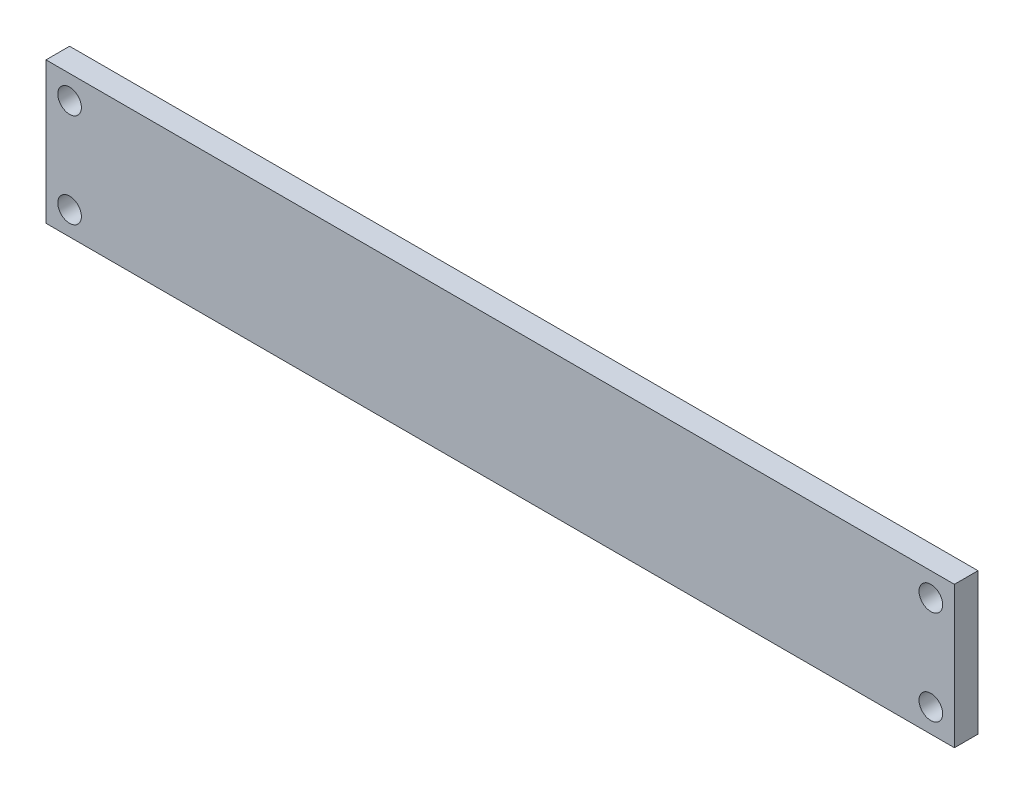
from build123d import *

# Parameters (mm, degrees)
SZKIC1_W                    = 385
SZKIC1_H                    = 60
SZKIC1_R                    = 5
DODANIE_WYCI_GNI_CIE1_DEPTH = 10


with BuildPart() as part:
    # Szkic1 → Dodanie-wyciągnięcie1 (new body)
    with BuildSketch(Plane.XY):
        Rectangle(SZKIC1_W, SZKIC1_H)
        with Locations((-182.5, 20)):
            Circle(SZKIC1_R, mode=Mode.SUBTRACT)
        with Locations((182.5, 20)):
            Circle(SZKIC1_R, mode=Mode.SUBTRACT)
        with Locations((182.5, -20)):
            Circle(SZKIC1_R, mode=Mode.SUBTRACT)
        with Locations((-182.5, -20)):
            Circle(SZKIC1_R, mode=Mode.SUBTRACT)
    extrude(amount=DODANIE_WYCI_GNI_CIE1_DEPTH)


solid = part.part
